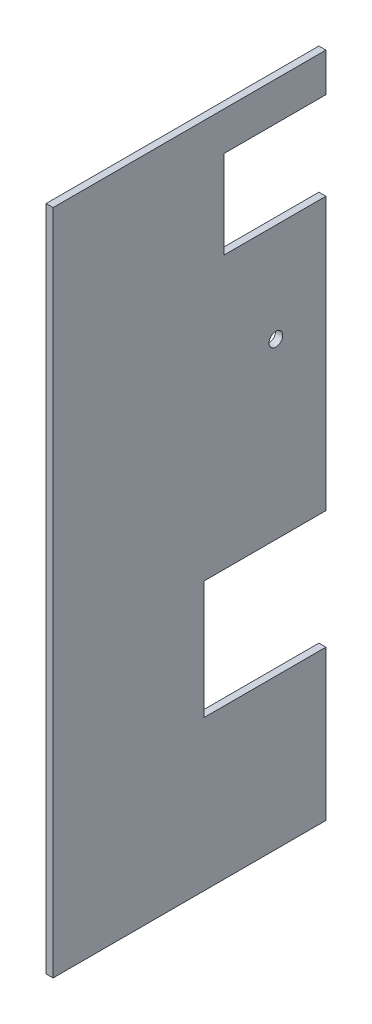
from build123d import *

# Parameters (mm, degrees)
SKETCH_1_W          = 95
SKETCH_1_H          = 38.85
EXTRUDE_1_DEPTH     = 0.5
SKETCH_2_W          = 38.85
SKETCH_2_H          = 95
EXTRUDE_2_DEPTH     = 0.5
SKETCH_3_W          = 20.065150591
SKETCH_3_H          = 12.517385588
CUT_EXTRUDE_1_DEPTH = 3
SKETCH_4_W          = 23.07389694
SKETCH_4_H          = 16.832919213
CUT_EXTRUDE_2_DEPTH = 3
SKETCH_5_R          = 0.973496531
CUT_EXTRUDE_3_DEPTH = 3


with BuildPart() as part:
    # Эскиз1 → Бобышка-Вытянуть1 (new body)
    with BuildSketch(Plane(origin=(0.5, 0, 0), x_dir=(0, -1, 0), z_dir=(-1, 0, 0))):
        with Locations((-53.35, 22.825)):
            Rectangle(SKETCH_1_W, SKETCH_1_H)
    extrude(amount=-EXTRUDE_1_DEPTH)

    # Эскиз2 → Бобышка-Вытянуть2 (add)
    with BuildSketch(Plane.ZY.offset(-0.5)):
        with Locations((22.825, 53.35)):
            Rectangle(SKETCH_2_W, SKETCH_2_H)
    extrude(amount=EXTRUDE_2_DEPTH)

    # Эскиз3 → Вырез-Вытянуть1 (cut)
    with BuildSketch(Plane.ZY):
        with Locations((7.88603419, 89.086980773)):
            Rectangle(SKETCH_3_W, SKETCH_3_H)
    extrude(amount=-CUT_EXTRUDE_1_DEPTH, mode=Mode.SUBTRACT)

    # Эскиз4 → Вырез-Вытянуть2 (cut)
    with BuildSketch(Plane.ZY):
        with Locations((9.208796156, 35.637729194)):
            Rectangle(SKETCH_4_W, SKETCH_4_H)
    extrude(amount=-CUT_EXTRUDE_2_DEPTH, mode=Mode.SUBTRACT)

    # Эскиз5 → Вырез-Вытянуть3 (cut)
    with BuildSketch(Plane.ZY):
        with Locations((10.527030872, 68.763270983)):
            Circle(SKETCH_5_R)
    extrude(amount=-CUT_EXTRUDE_3_DEPTH, mode=Mode.SUBTRACT)


solid = part.part
